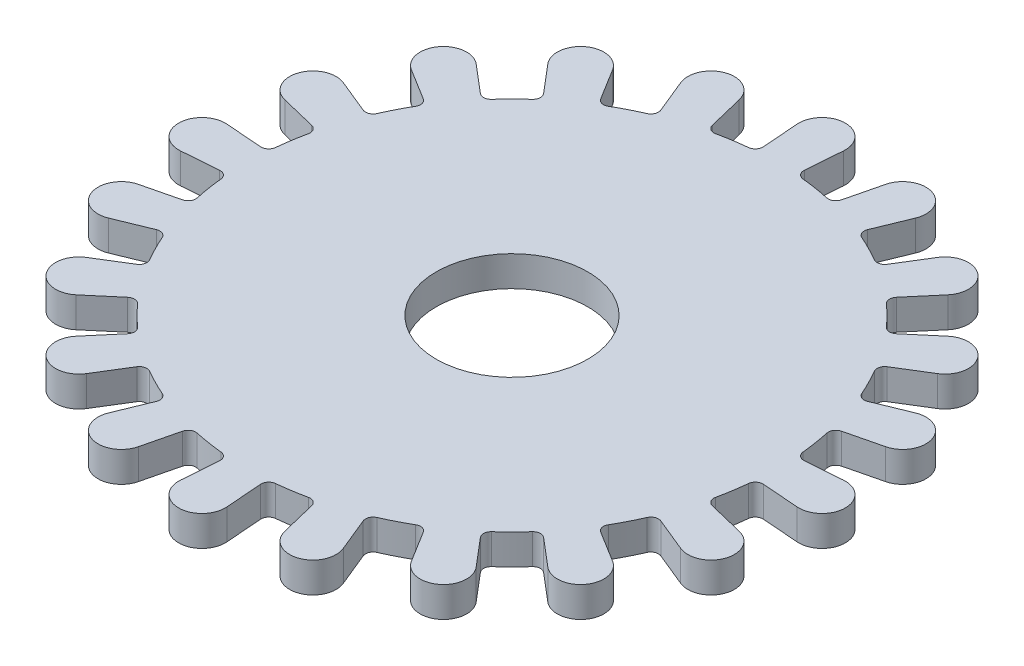
from build123d import *

# Parameters (mm, degrees)
SKETCH_1_R               = 8.75
EXTRUDE_1_DEPTH          = 1
EXTRUDE_2_DEPTH          = 1
SKETCH_3_R               = 2.5
CUT_EXTRUDE_1_DEPTH      = 15.091220671
PATTERN_CIRCULAR_1_COUNT = 20
FILLET_1_R               = 0.25


with BuildPart() as part:
    # 草图1 → 凸台-拉伸1 (new body)
    with BuildSketch(Plane(origin=(0, 0, 0), x_dir=(1, 0, 0), z_dir=(0, 1, 0))):
        with Locations(Location((0, 0, 0), (0, 0, 270))):
            Circle(SKETCH_1_R)
    extrude(amount=-EXTRUDE_1_DEPTH)

    # 草图2 → 凸台-拉伸2 (add)
    with BuildSketch(Plane(origin=(0, 0, 0), x_dir=(1, 0, 0), z_dir=(0, 1, 0))):
        with BuildLine():
            Line((-0.765280386, -10.175), (-0.65625, -8.72535592))
            ThreePointArc((-0.65625, -8.72535592), (0, -8.75), (0.65625, -8.72535592))
            Line((0.65625, -8.72535592), (0.765280386, -10.175))
            ThreePointArc((0.765280386, -10.175), (0, -11), (-0.765280386, -10.175))
        make_face()
    extrude_2 = extrude(amount=-EXTRUDE_2_DEPTH)

    # 草图3 → 切除-拉伸1 (cut, through all)
    with BuildSketch(Plane(origin=(0, 0, 0), x_dir=(1, 0, 0), z_dir=(0, 1, 0))):
        with Locations(Location((0, 0, 0), (0, 0, 270))):
            Circle(SKETCH_3_R)
    extrude(amount=-CUT_EXTRUDE_1_DEPTH, mode=Mode.SUBTRACT)

    # 阵列(圆周)1: 凸台-拉伸2 ×20 about axis
    pattern_circular_1_axis = Axis((0, 0, 0), (0, 1, 0))
    for i in range(1, PATTERN_CIRCULAR_1_COUNT):
        add(extrude_2.rotate(pattern_circular_1_axis, i * 360 / PATTERN_CIRCULAR_1_COUNT))

    # 圆角1
    fillet_1_edges = [part.edges().sort_by_distance(p)[0] for p in [
        (3.3204141, -0.5, -8.095514203),
        (2.072152423, -0.5, -8.501099008),
        (0.65625, -0.5, -8.72535592),
        (-0.65625, -0.5, -8.72535592),
        (-2.072152423, -0.5, -8.501099008),
        (-3.3204141, -0.5, -8.095514203),
        (-4.597718128, -0.5, -7.444695293),
        (-5.659552934, -0.5, -6.67322715),
        (-6.67322715, -0.5, -5.659552934),
        (-7.444695293, -0.5, -4.597718128),
        (-8.095514203, -0.5, -3.3204141),
        (-8.501099008, -0.5, -2.072152423),
        (-8.72535592, -0.5, -0.65625),
        (-8.72535592, -0.5, 0.65625),
        (-8.501099008, -0.5, 2.072152423),
        (-8.095514203, -0.5, 3.3204141),
        (-7.444695293, -0.5, 4.597718128),
        (-6.67322715, -0.5, 5.659552934),
        (-5.659552934, -0.5, 6.67322715),
        (-4.597718128, -0.5, 7.444695293),
        (-3.3204141, -0.5, 8.095514203),
        (-2.072152423, -0.5, 8.501099008),
        (2.072152423, -0.5, 8.501099008),
        (3.3204141, -0.5, 8.095514203),
        (4.597718128, -0.5, 7.444695293),
        (5.659552934, -0.5, 6.67322715),
        (6.67322715, -0.5, 5.659552934),
        (7.444695293, -0.5, 4.597718128),
        (8.095514203, -0.5, 3.3204141),
        (8.501099008, -0.5, 2.072152423),
        (8.72535592, -0.5, 0.65625),
        (8.72535592, -0.5, -0.65625),
        (-0.65625, -0.5, 8.72535592),
        (0.65625, -0.5, 8.72535592),
        (8.501099008, -0.5, -2.072152423),
        (8.095514203, -0.5, -3.3204141),
        (7.444695293, -0.5, -4.597718128),
        (6.67322715, -0.5, -5.659552934),
        (5.659552934, -0.5, -6.67322715),
        (4.597718128, -0.5, -7.444695293),
    ]]
    fillet(fillet_1_edges, radius=FILLET_1_R)


solid = part.part
